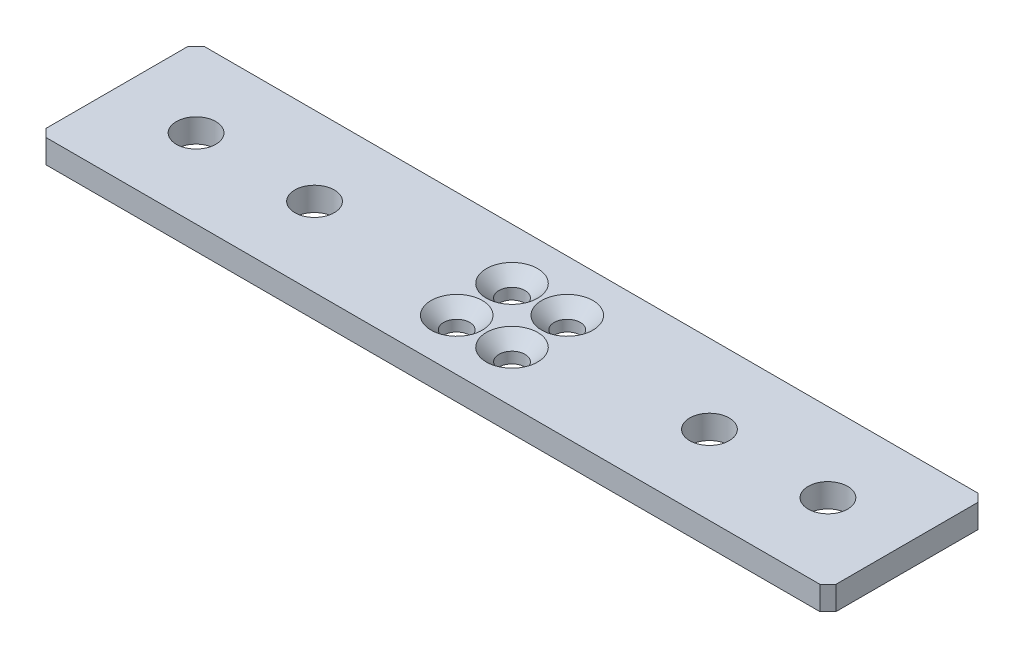
from build123d import *

# Parameters (mm, degrees)
SKETCH1_W                                    = 200
SKETCH1_H                                    = 40
BOSS_EXTRUDE1_DEPTH                          = 6
CSK_FOR_M6_COUNTERSUNK_FLAT_HEAD_SCR_2_COUNT = 2
CSK_FOR_M6_COUNTERSUNK_FLAT_HEAD_SCR_2_PITCH = 14
CSK_FOR_M6_COUNTERSUNK_FLAT_HEAD_SCR_3_COUNT = 2
CSK_FOR_M6_COUNTERSUNK_FLAT_HEAD_SCR_3_PITCH = 19.798989873
CSK_FOR_M6_COUNTERSUNK_FLAT_HEAD_SCR_4_COUNT = 2
CSK_FOR_M6_COUNTERSUNK_FLAT_HEAD_SCR_4_PITCH = 14
CHAMFER1_SIZE                                = 2
SKETCH8_R                                    = 5
CUT_EXTRUDE1_DEPTH                           = 103.156742313


with BuildPart() as part:
    # Sketch1 → Boss-Extrude1 (new body)
    with BuildSketch(Plane(origin=(0, 0, 0), x_dir=(1, 0, 0), z_dir=(0, 1, 0))):
        Rectangle(SKETCH1_W, SKETCH1_H)
    extrude(amount=BOSS_EXTRUDE1_DEPTH)

    # Sketch5 → CSK for M6 Countersunk Flat Head Screw1 (revolve, cut)
    with BuildSketch(Plane(origin=(-7, 6, -7), x_dir=(0, 0, 1), z_dir=(1, 0, 0))):
        Polygon((0, 0), (0, 6), (3.3, 6), (3.3, 3.2), (6.5, 0), align=None)
    csk_for_m6_countersunk_flat_head_screw1 = revolve(axis=Axis((-7, 12.35, -7), (0, -1, 0)), mode=Mode.SUBTRACT)

    # CSK for M6 Countersunk Flat Head Scr 2: CSK for M6 Countersunk Flat Head Screw1 ×2
    with Locations(*[(i * CSK_FOR_M6_COUNTERSUNK_FLAT_HEAD_SCR_2_PITCH, 0, 0) for i in range(1, CSK_FOR_M6_COUNTERSUNK_FLAT_HEAD_SCR_2_COUNT)]):
        add(csk_for_m6_countersunk_flat_head_screw1, mode=Mode.SUBTRACT)

    # CSK for M6 Countersunk Flat Head Scr 3: CSK for M6 Countersunk Flat Head Screw1 ×2
    with Locations(*[Vector(0.7071067811865476, 0, 0.7071067811865476) * (i * CSK_FOR_M6_COUNTERSUNK_FLAT_HEAD_SCR_3_PITCH) for i in range(1, CSK_FOR_M6_COUNTERSUNK_FLAT_HEAD_SCR_3_COUNT)]):
        add(csk_for_m6_countersunk_flat_head_screw1, mode=Mode.SUBTRACT)

    # CSK for M6 Countersunk Flat Head Scr 4: CSK for M6 Countersunk Flat Head Screw1 ×2
    with Locations(*[(0, 0, i * CSK_FOR_M6_COUNTERSUNK_FLAT_HEAD_SCR_4_PITCH) for i in range(1, CSK_FOR_M6_COUNTERSUNK_FLAT_HEAD_SCR_4_COUNT)]):
        add(csk_for_m6_countersunk_flat_head_screw1, mode=Mode.SUBTRACT)

    # Chamfer1
    chamfer1_edges = [part.edges().sort_by_distance(p)[0] for p in [
        (-100, 3, 20),
        (-100, 3, -20),
        (100, 3, -20),
        (100, 3, 20),
    ]]
    chamfer(chamfer1_edges, length=CHAMFER1_SIZE)

    # Sketch8 → Cut-Extrude1 (cut, through all)
    with BuildSketch(Plane(origin=(0, 6, 0), x_dir=(1, 0, 0), z_dir=(0, 1, 0))):
        with Locations(Location((-50, 0, 0), (0, 0, 270))):
            Circle(SKETCH8_R)
        with Locations(Location((-80, 0, 0), (0, 0, 270))):
            Circle(SKETCH8_R)
    cut_extrude1 = extrude(amount=-CUT_EXTRUDE1_DEPTH, mode=Mode.SUBTRACT)

    # Mirror1: Cut-Extrude1 across plane
    add(cut_extrude1.mirror(Plane(origin=(0, 0, 0), x_dir=(0, 0, 1), z_dir=(1, 0, 0))), mode=Mode.SUBTRACT)


solid = part.part
